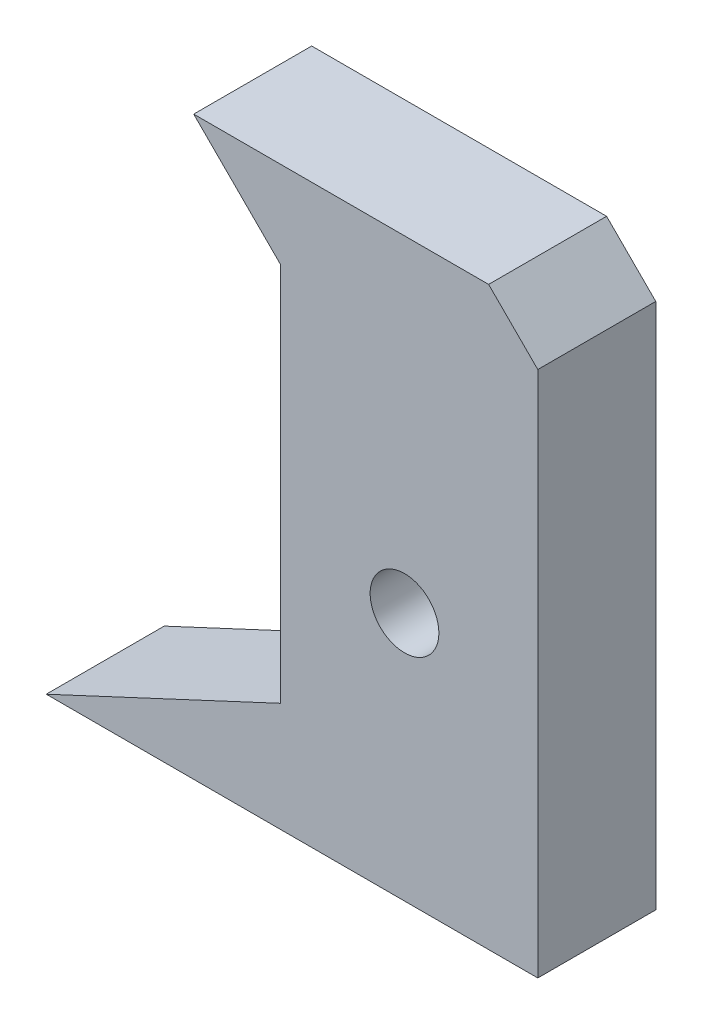
from build123d import *

# Parameters (mm, degrees)
BOSS_EXTRUDE1_DEPTH = 12
SKETCH3_R           = 3.495
CUT_EXTRUDE2_DEPTH  = 78.961272437
CHAMFER1_SIZE       = 5


with BuildPart() as part:
    # Sketch1 → Boss-Extrude1 (new body)
    with BuildSketch(Plane.XY):
        Polygon((0, 0), (0, 58.6), (-35, 58.6), (-26.195973182, 49.795973182), (-26.195973182, 11.1), (-50, 0), align=None)
    extrude(amount=BOSS_EXTRUDE1_DEPTH)

    # Sketch3 → Cut-Extrude2 (cut, through all)
    with BuildSketch(Plane.XY.offset(12)):
        with Locations((-13.556619589, 25.36)):
            Circle(SKETCH3_R)
    extrude(amount=-CUT_EXTRUDE2_DEPTH, mode=Mode.SUBTRACT)

    # Chamfer1
    chamfer1_edges = [part.edges().sort_by_distance(p)[0] for p in [
        (0, 58.6, 6),
    ]]
    chamfer(chamfer1_edges, length=CHAMFER1_SIZE)


solid = part.part
